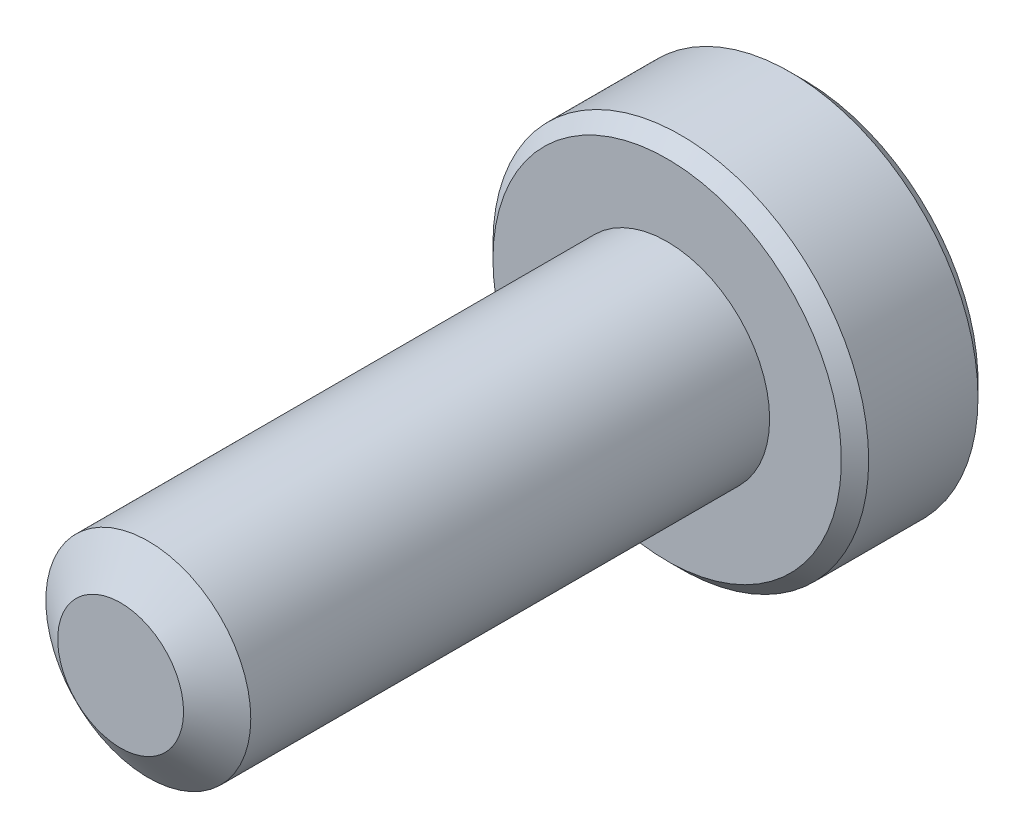
from build123d import *

# Parameters (mm, degrees)
SKETCH1_R          = 1.5
EXTRUDE1_DEPTH     = 8
SKETCH6_R          = 2.75
EXTRUDE2_DEPTH     = 2
CUT_EXTRUDE1_DEPTH = 1.5
CHAMFER1_SIZE      = 0.2


with BuildPart() as part:
    # Sketch1 → Extrude1 (new body)
    with BuildSketch(Plane.XY):
        Circle(SKETCH1_R)
    extrude(amount=-EXTRUDE1_DEPTH)

    # Sketch4 → Cut-Revolve1 (revolve, cut)
    with BuildSketch(Plane(origin=(0, 0, 0), x_dir=(0, 0, -1), z_dir=(1, 0, 0))):
        Polygon((0.405251783, 1.5), (0, 0.921240474), (0, 1.5), align=None)
    revolve(axis=Axis((0, 0, 0), (0, 0, -1)), mode=Mode.SUBTRACT)

    # Sketch6 → Extrude2 (add)
    with BuildSketch(Plane(origin=(0, 0, -8), x_dir=(-1, 0, 0), z_dir=(0, 0, -1))):
        Circle(SKETCH6_R)
    extrude(amount=EXTRUDE2_DEPTH)

    # Sketch7 → Cut-Extrude1 (cut)
    with BuildSketch(Plane(origin=(0, 0, -10), x_dir=(-1, 0, 0), z_dir=(0, 0, -1))):
        Polygon((0, 1.154700538), (-1, 0.577350269), (-1, -0.577350269), (0, -1.154700538), (1, -0.577350269), (1, 0.577350269), align=None)
    extrude(amount=-CUT_EXTRUDE1_DEPTH, mode=Mode.SUBTRACT)

    # Cut-Extrude2 cone 1 section (through the dimple's axis) → Cut-Extrude2 (revolve, cut)
    with BuildSketch(Plane(origin=(0, 0, -10), x_dir=(0, 1, 0), z_dir=(1, 0, 0))):
        Polygon((0, 0), (1.154700538, 0), (0, 1.154700538), align=None)
    revolve(axis=Axis((0, 0, -10), (0, 0, 1)), mode=Mode.SUBTRACT)

    # Chamfer1
    chamfer1_edges = [part.edges().sort_by_distance(p)[0] for p in [
        (2.75, 0, -10),
        (2.75, 0, -8),
    ]]
    chamfer(chamfer1_edges, length=CHAMFER1_SIZE)


solid = part.part
